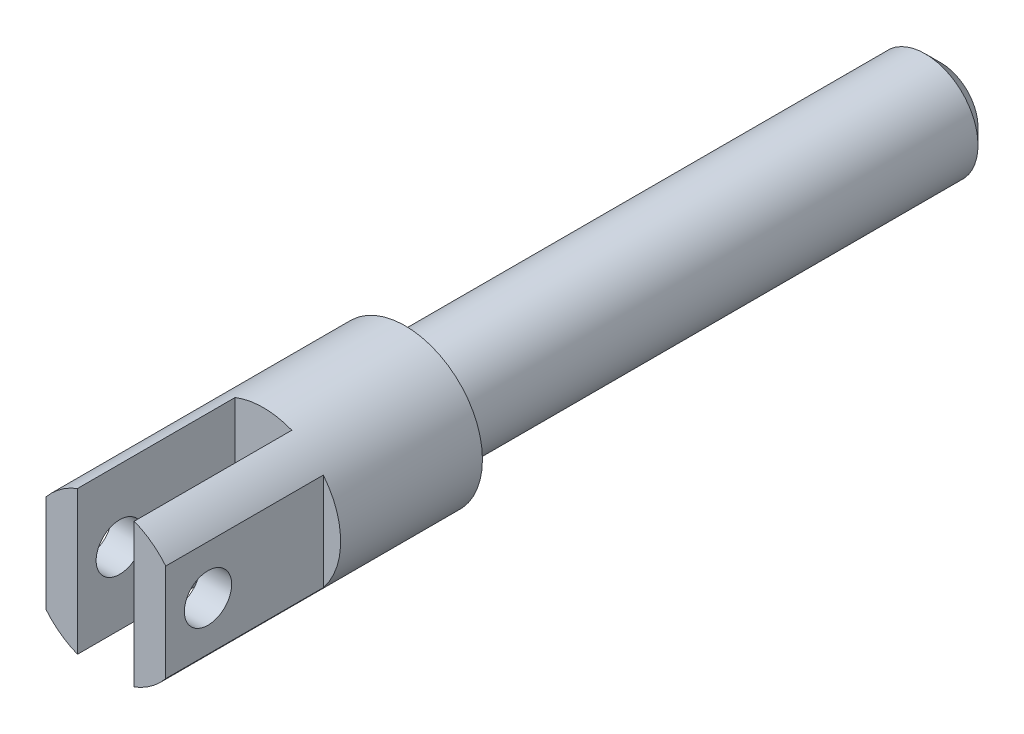
from build123d import *
from build123d.topology import SkipClean

# Parameters (mm, degrees)
SKETCH_2_R          = 4.9
EXTRUDE_1_DEPTH     = 9
EXTRUDE_2_DEPTH     = 10
SKETCH_4_R          = 1.5
CUT_EXTRUDE_1_DEPTH = 22.46392322
SKETCH_5_R          = 3.35
EXTRUDE_3_DEPTH     = 34
CHAMFER_1_SIZE      = 1


with BuildPart() as part:
    # 草图2 → 凸台-拉伸1 (new body)
    with BuildSketch(Plane.XY):
        Circle(SKETCH_2_R)
    extrude(amount=EXTRUDE_1_DEPTH)

    # 草图3 → 凸台-拉伸2 (add)
    with SkipClean():  # the faces are left unmerged after this step: merging them gives an invalid solid
        with BuildSketch(Plane.XY.offset(9)):
            with BuildLine():
                Line((-1.8, -4.557411546), (-1.8, 4.557411546))
                ThreePointArc((-1.8, 4.557411546), (-2.894085134, 3.954019631), (-3.8, 3.09354166))
                Line((-3.8, 3.09354166), (-3.8, -3.09354166))
                ThreePointArc((-3.8, -3.09354166), (-2.894085134, -3.954019631), (-1.8, -4.557411546))
            make_face()
            with BuildLine():
                Line((1.8, -4.557411546), (1.8, 4.557411546))
                ThreePointArc((1.8, 4.557411546), (2.894085134, 3.954019631), (3.8, 3.09354166))
                Line((3.8, 3.09354166), (3.8, -3.09354166))
                ThreePointArc((3.8, -3.09354166), (2.894085134, -3.954019631), (1.8, -4.557411546))
            make_face()
        extrude(amount=EXTRUDE_2_DEPTH)

    # 草图4 → 切除-拉伸1 (cut, through all)
    with SkipClean():  # the faces are left unmerged after this step: merging them gives an invalid solid
        with BuildSketch(Plane.ZY.offset(3.8)):
            with Locations((16.318814586, 0)):
                Circle(SKETCH_4_R)
        extrude(amount=-CUT_EXTRUDE_1_DEPTH, mode=Mode.SUBTRACT)

    # 草图5 → 凸台-拉伸3 (add)
    with SkipClean():  # the faces are left unmerged after this step: merging them gives an invalid solid
        with BuildSketch(Plane(origin=(0, 0, 0), x_dir=(-1, 0, 0), z_dir=(0, 0, -1))):
            with Locations(Location((0, 0, 0), (0, 0, 180))):
                Circle(SKETCH_5_R)
        extrude(amount=EXTRUDE_3_DEPTH)

    # 倒角1
    chamfer_1_edges = [part.edges().sort_by_distance(p)[0] for p in [
        (-3.35, 0, -34),
    ]]
    chamfer(chamfer_1_edges, length=CHAMFER_1_SIZE)


solid = part.part
